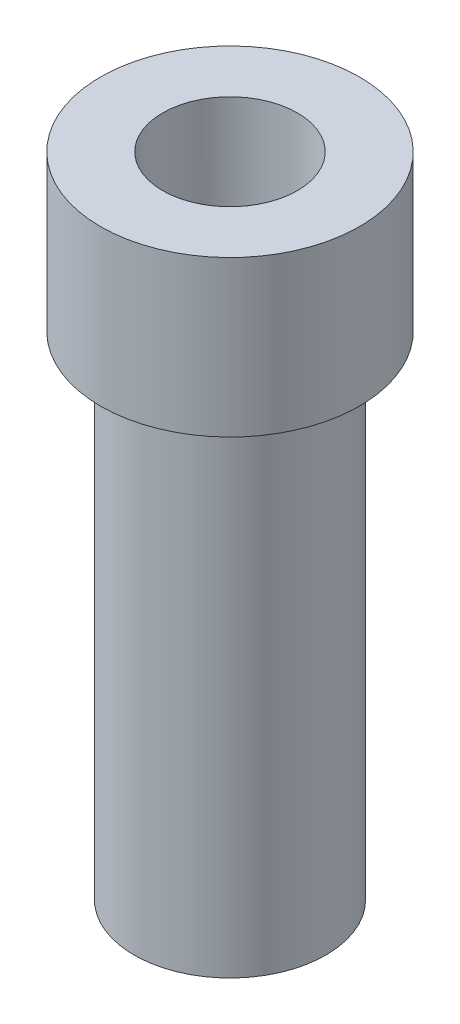
from build123d import *

# Parameters (mm, degrees)
SKETCH1_R           = 9.25
SKETCH1_R_2         = 6.5
BOSS_EXTRUDE1_DEPTH = 62.5
BOSS_EXTRUDE2_START = -15
SKETCH3_R           = 12.5
SKETCH3_R_2         = 6.5
BOSS_EXTRUDE2_DEPTH = 15
BOSS_EXTRUDE3_START = 2.51
SKETCH4_R           = 9.25
SKETCH4_R_2         = 6.5
BOSS_EXTRUDE3_DEPTH = 2.51
BOSS_EXTRUDE4_START = 2.51
SKETCH5_R           = 12.5
SKETCH5_R_2         = 9.25
BOSS_EXTRUDE4_DEPTH = 2.51
CUT_EXTRUDE1_START  = -2.51
SKETCH6_R           = 12.5
SKETCH6_R_2         = 6.5
CUT_EXTRUDE1_DEPTH  = 2.51


with BuildPart() as part:
    # Sketch1 → Boss-Extrude1 (new body)
    with BuildSketch(Plane(origin=(0, 0, 0), x_dir=(1, 0, 0), z_dir=(0, 1, 0))):
        with Locations(Location((0, 0, 0), (0, 0, 270))):
            Circle(SKETCH1_R)
        with Locations(Location((0, 0, 0), (0, 0, 270))):
            Circle(SKETCH1_R_2, mode=Mode.SUBTRACT)
    extrude(amount=BOSS_EXTRUDE1_DEPTH)

    # Sketch3 → Boss-Extrude2 (add)
    with BuildSketch(Plane(origin=(0, 62.5, 0), x_dir=(1, 0, 0), z_dir=(0, 1, 0)).offset(BOSS_EXTRUDE2_START)):
        with Locations(Location((0, 0, 0), (0, 0, 270))):
            Circle(SKETCH3_R)
        with Locations(Location((0, 0, 0), (0, 0, 270))):
            Circle(SKETCH3_R_2, mode=Mode.SUBTRACT)
    extrude(amount=BOSS_EXTRUDE2_DEPTH)

    # Sketch4 → Boss-Extrude3 (add)
    with BuildSketch(Plane.XZ.offset(BOSS_EXTRUDE3_START)):
        with Locations(Location((0, 0, 0), (0, 0, 270))):
            Circle(SKETCH4_R)
        with Locations(Location((0, 0, 0), (0, 0, 270))):
            Circle(SKETCH4_R_2, mode=Mode.SUBTRACT)
    extrude(amount=-BOSS_EXTRUDE3_DEPTH)

    # Sketch5 → Boss-Extrude4 (add)
    with BuildSketch(Plane.XZ.offset(-47.5).offset(BOSS_EXTRUDE4_START)):
        with Locations(Location((0, 0, 0), (0, 0, 90))):
            Circle(SKETCH5_R)
        with Locations(Location((0, 0, 0), (0, 0, 270))):
            Circle(SKETCH5_R_2, mode=Mode.SUBTRACT)
    extrude(amount=-BOSS_EXTRUDE4_DEPTH)

    # Sketch6 → Cut-Extrude1 (cut)
    with BuildSketch(Plane(origin=(0, 62.5, 0), x_dir=(1, 0, 0), z_dir=(0, 1, 0)).offset(CUT_EXTRUDE1_START)):
        with Locations(Location((0, 0, 0), (0, 0, 270))):
            Circle(SKETCH6_R)
        with Locations(Location((0, 0, 0), (0, 0, 90))):
            Circle(SKETCH6_R_2, mode=Mode.SUBTRACT)
    extrude(amount=CUT_EXTRUDE1_DEPTH, mode=Mode.SUBTRACT)


solid = part.part
